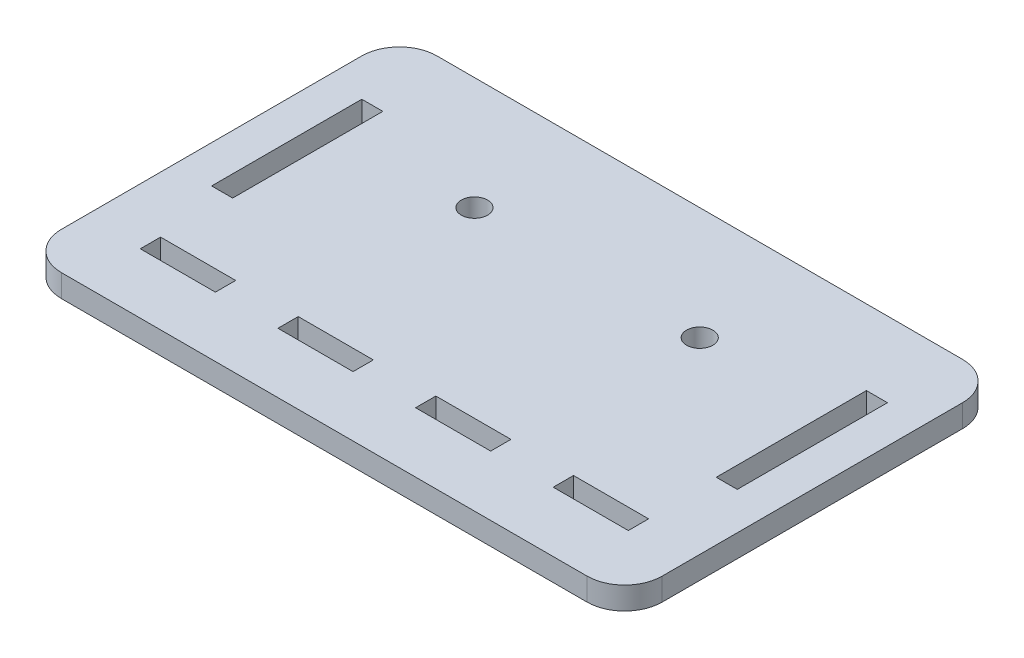
from build123d import *

# Parameters (mm, degrees)
SKETCH1_W           = 80
SKETCH1_H           = 50
SKETCH1_W_2         = 10
SKETCH1_H_2         = 2.7
SKETCH1_W_3         = 2.8
SKETCH1_H_3         = 20
BOSS_EXTRUDE1_DEPTH = 3
SKETCH2_R           = 1.75
CUT_EXTRUDE1_DEPTH  = 3
FILLET1_R           = 5


with BuildPart() as part:
    # Sketch1 → Boss-Extrude1 (new body)
    with BuildSketch(Plane(origin=(0, 0, 0), x_dir=(1, 0, 0), z_dir=(0, 1, 0))):
        Rectangle(SKETCH1_W, SKETCH1_H)
        with Locations((-9.17, -15.65)):
            Rectangle(SKETCH1_W_2, SKETCH1_H_2, mode=Mode.SUBTRACT)
        with Locations((-27.5, -15.65)):
            Rectangle(SKETCH1_W_2, SKETCH1_H_2, mode=Mode.SUBTRACT)
        with Locations((9.16, -15.65)):
            Rectangle(SKETCH1_W_2, SKETCH1_H_2, mode=Mode.SUBTRACT)
        with Locations((27.49, -15.65)):
            Rectangle(SKETCH1_W_2, SKETCH1_H_2, mode=Mode.SUBTRACT)
        with Locations((-33.6, 5)):
            Rectangle(SKETCH1_W_3, SKETCH1_H_3, mode=Mode.SUBTRACT)
        with Locations((33.6, 5)):
            Rectangle(SKETCH1_W_3, SKETCH1_H_3, mode=Mode.SUBTRACT)
    extrude(amount=BOSS_EXTRUDE1_DEPTH)

    # Sketch2 → Cut-Extrude1 (cut)
    with BuildSketch(Plane(origin=(0, 3, 0), x_dir=(1, 0, 0), z_dir=(0, 1, 0))):
        with Locations(Location((15, 10, 0), (0, 0, 270))):
            Circle(SKETCH2_R)
        with Locations(Location((-15, 10, 0), (0, 0, 270))):
            Circle(SKETCH2_R)
    extrude(amount=-CUT_EXTRUDE1_DEPTH, mode=Mode.SUBTRACT)

    # Fillet1
    fillet1_edges = [part.edges().sort_by_distance(p)[0] for p in [
        (-40, 1.5, -25),
        (40, 1.5, -25),
        (40, 1.5, 25),
        (-40, 1.5, 25),
    ]]
    fillet(fillet1_edges, radius=FILLET1_R)


solid = part.part
